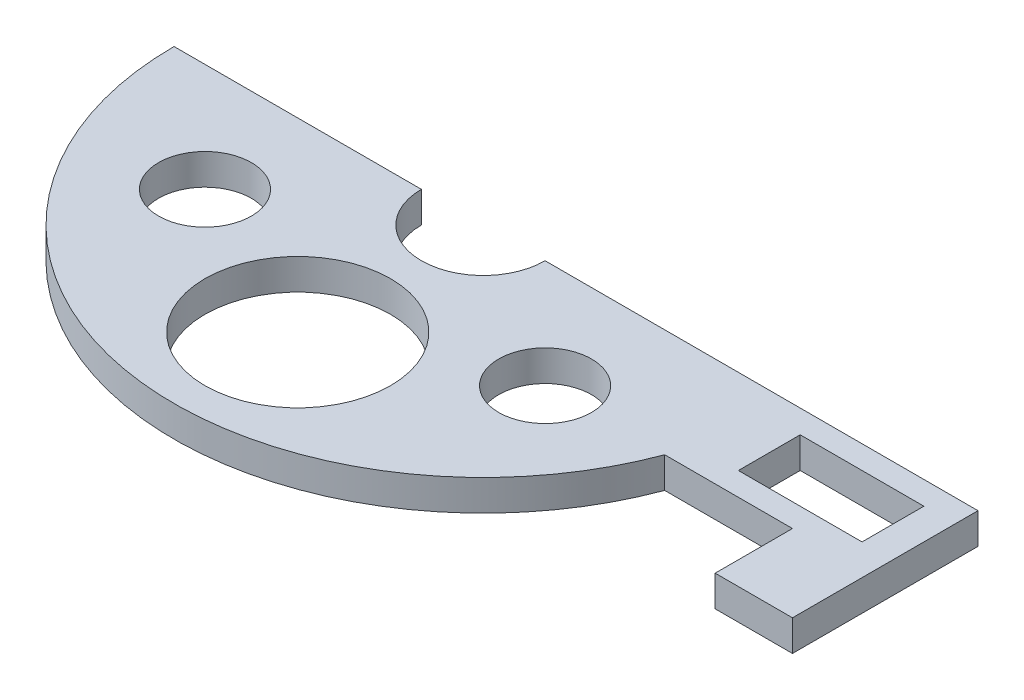
from build123d import *

# Parameters (mm, degrees)
SKETCH1_R           = 0.75
BOSS_EXTRUDE1_DEPTH = 0.5


with BuildPart() as part:
    # Sketch1 → Boss-Extrude1 (new body)
    with BuildSketch(Plane(origin=(0, 0, 0), x_dir=(1, 0, 0), z_dir=(0, 1, 0))):
        with BuildLine():
            Line((-39.503518064, 27.177881063), (-43.503518064, 27.177881063))
            ThreePointArc((-43.503518064, 27.177881063), (-39.392691136, 22.257579116), (-33.819769565, 25.427881063))
            Line((-33.819769565, 25.427881063), (-31.753518064, 25.427881063))
            Line((-31.753518064, 25.427881063), (-31.753518064, 24.177881063))
            Line((-31.753518064, 24.177881063), (-30.503518064, 24.177881063))
            Line((-30.503518064, 24.177881063), (-30.503518064, 26.302881063))
            Line((-30.503518064, 26.302881063), (-30.503518064, 27.177881063))
            Line((-30.503518064, 27.177881063), (-37.503518064, 27.177881063))
            ThreePointArc((-37.503518064, 27.177881063), (-37.796411282, 26.470774282), (-38.503518064, 26.177881063))
            ThreePointArc((-38.503518064, 26.177881063), (-39.210624845, 26.470774282), (-39.503518064, 27.177881063))
        make_face()
        with BuildLine():
            ThreePointArc((-40.003518064, 24.177881063), (-39.564178235, 25.238541235), (-38.503518064, 25.677881063))
            ThreePointArc((-38.503518064, 25.677881063), (-37.442857892, 25.238541235), (-37.003518064, 24.177881063))
            ThreePointArc((-37.003518064, 24.177881063), (-38.503518064, 22.677881063), (-40.003518064, 24.177881063))
        make_face(mode=Mode.SUBTRACT)
        with Locations((-41.253518064, 25.427881063)):
            Circle(SKETCH1_R, mode=Mode.SUBTRACT)
        with Locations((-35.753518064, 25.427881063)):
            Circle(SKETCH1_R, mode=Mode.SUBTRACT)
        Polygon((-31.003518064, 26.802881063), (-31.003518064, 26.302881063), (-31.003518064, 25.802881063), (-33.003518064, 25.802881063), (-33.003518064, 26.802881063), align=None, mode=Mode.SUBTRACT)
    extrude(amount=BOSS_EXTRUDE1_DEPTH)


solid = part.part
